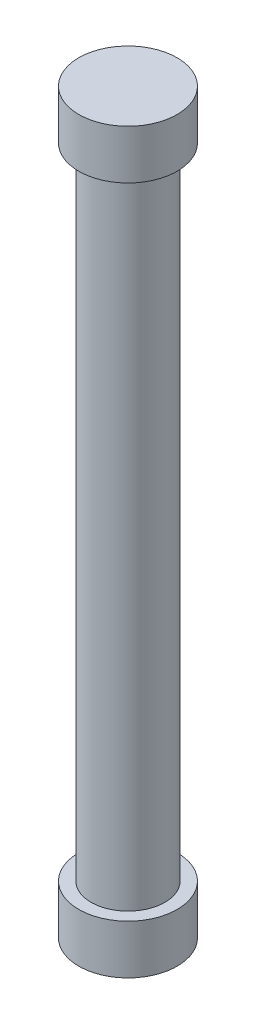
from build123d import *


with BuildPart() as part:
    # Sketch1 → Revolve1 (revolve)
    with BuildSketch(Plane.XY):
        Polygon((0, 26.025205426), (0, -3.974794574), (-2, -3.974794574), (-2, -1.974794574), (-1.5, -1.974794574), (-1.5, 24.025205426), (-2, 24.025205426), (-2, 26.025205426), align=None)
    revolve(axis=Axis((0, 26.025205426, 0), (0, -1, 0)))


solid = part.part
